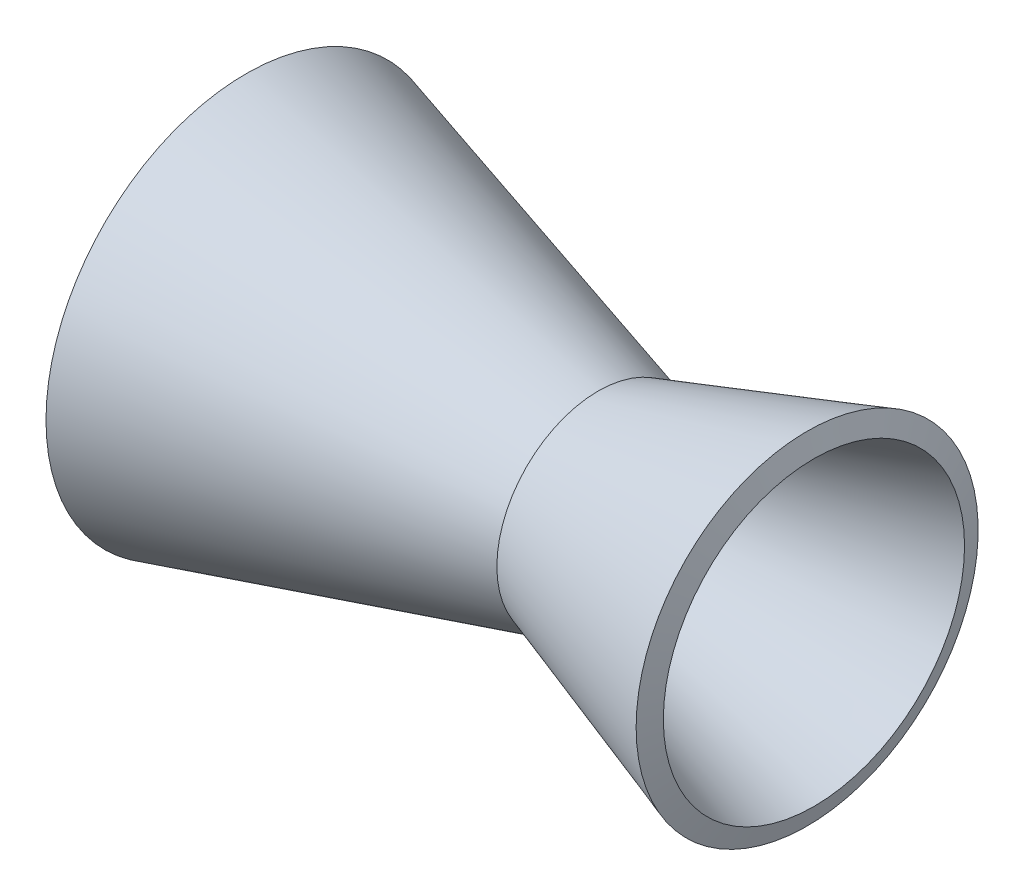
from build123d import *


with BuildPart() as part:
    # Sketch1 → Revolve-Thin1 (revolve)
    with BuildSketch(Plane.XY, mode=Mode.PRIVATE) as revolve_thin1_sk:
        Polygon((20, 25), (70, 11), (100, 21), (99.051316702, 23.846049894), (69.923538375, 14.136790452), (20.808889777, 27.888892059), align=None)
    revolve(revolve_thin1_sk.sketch.rotate(Axis((0, 0, 0), (1, 0, 0)), 90), axis=Axis((0, 0, 0), (1, 0, 0)))


solid = part.part
